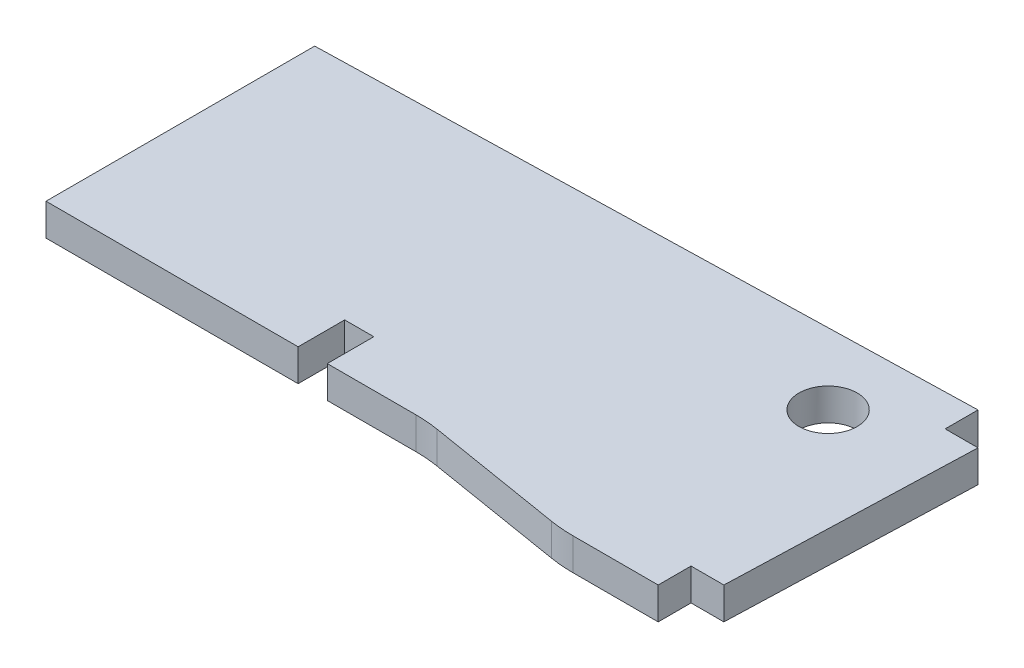
from build123d import *

# Parameters (mm, degrees)
BOSS_EXTRUDE1_DEPTH = 2.8448
FILLET1_R           = 12.7
CUT_EXTRUDE1_REACH  = 67.623
SKETCH2_W           = 2.5908
SKETCH2_H           = 4.1402
CUT_EXTRUDE2_REACH  = 67.623
SKETCH3_R           = 2.5908


with BuildPart() as part:
    # Sketch1 → Boss-Extrude1 (new body)
    with BuildSketch(Plane(origin=(0, 0, 0), x_dir=(1, 0, 0), z_dir=(0, 1, 0))):
        Polygon((0, 0), (0, 23.9014), (57.531, 25.3746), (57.531, 22.4536), (60.452, 22.4536), (59.7154, 0.5842), (56.7944, 0.5842), (56.7944, -2.3368), (48.1584, -2.3368), (33.9344, 0), align=None)
    extrude(amount=BOSS_EXTRUDE1_DEPTH)

    # Fillet1
    fillet1_edges = [part.edges().sort_by_distance(p)[0] for p in [
        (48.1584, 1.4224, 2.3368),
        (33.9344, 1.4224, 0),
    ]]
    fillet(fillet1_edges, radius=FILLET1_R)

    # Sketch2 → Cut-Extrude1 (cut, up to next)
    with BuildSketch(Plane(origin=(0, 2.8448, 0), x_dir=(1, 0, 0), z_dir=(0, 1, 0)), mode=Mode.PRIVATE) as cut_extrude1_sk1:
        with Locations((23.7236, 2.0701)):
            Rectangle(SKETCH2_W, SKETCH2_H)
    cut_extrude1_tool1 = extrude(cut_extrude1_sk1.sketch, amount=-CUT_EXTRUDE1_REACH, mode=Mode.PRIVATE) & part.part
    add(cut_extrude1_tool1.solids().sort_by_distance((23.7236, 2.8448, -2.0701))[0], mode=Mode.SUBTRACT)

    # Sketch3 → Cut-Extrude2 (cut, up to next)
    with BuildSketch(Plane(origin=(0, 2.8448, 0), x_dir=(1, 0, 0), z_dir=(0, 1, 0)), mode=Mode.PRIVATE) as cut_extrude2_sk1:
        with Locations(Location((50.8508, 18.7198, 0), (0, 0, 270))):
            Circle(SKETCH3_R)
    cut_extrude2_tool1 = extrude(cut_extrude2_sk1.sketch, amount=-CUT_EXTRUDE2_REACH, mode=Mode.PRIVATE) & part.part
    add(cut_extrude2_tool1.solids().sort_by_distance((50.8508, 2.8448, -18.7198))[0], mode=Mode.SUBTRACT)


solid = part.part
